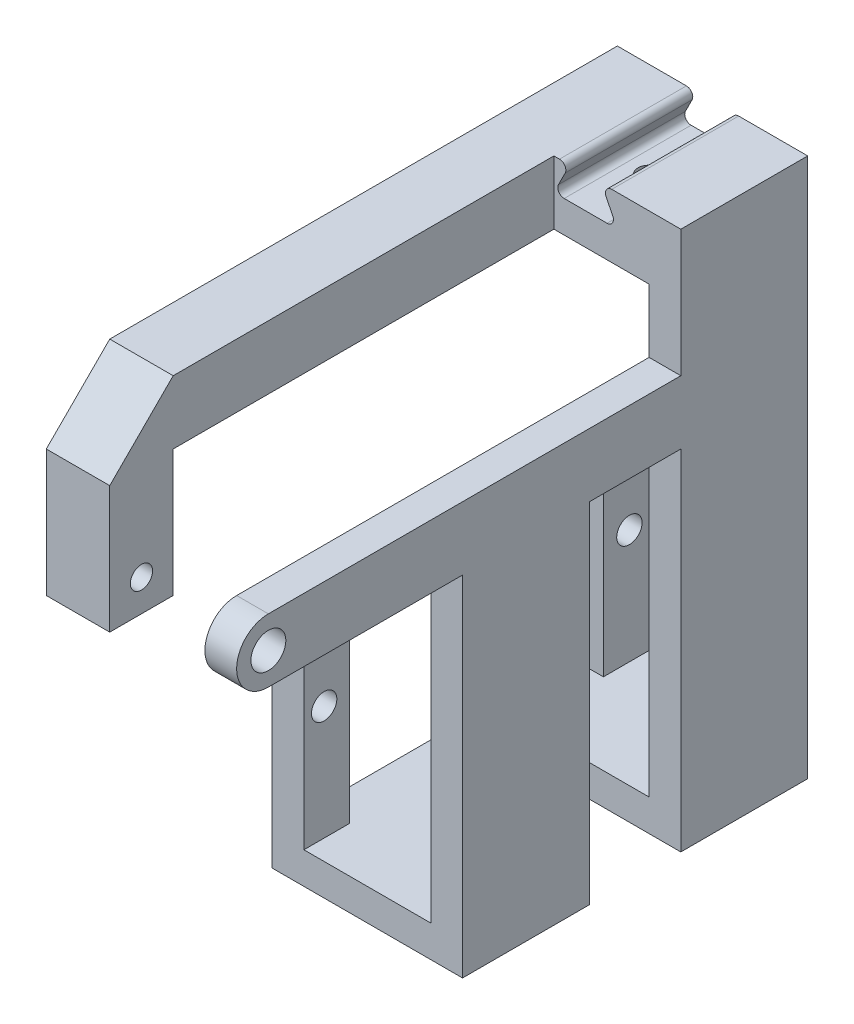
from build123d import *

# Parameters (mm, degrees)
ESBO_O1_W                   = 5
ESBO_O1_H                   = 33
RESSALTO_EXTRUS_O1_DEPTH    = 80
ESBO_O2_W                   = 40
ESBO_O2_H                   = 33
ESBO_O2_W_2                 = 25.6
CORTE_EXTRUS_O1_DEPTH       = 19
ESBO_O4_R                   = 2
CORTE_EXTRUS_O3_DEPTH       = 12
ESBO_O5_W                   = 10
ESBO_O5_H                   = 20
RESSALTO_EXTRUS_O2_DEPTH    = 10
ESBO_O6_R                   = 1.75
CORTE_EXTRUS_O4_DEPTH       = 15
CORTE_EXTRUS_O5_DEPTH       = 5
ESBO_O8_R                   = 5
ESBO_O8_R_2                 = 2.75
RESSALTO_EXTRUS_O3_DEPTH    = 5
ESBO_O9_W                   = 20
ESBO_O9_H                   = 20
ESBO_O9_W_2                 = 25
ESBO_O9_H_2                 = 10
CORTE_EXTRUS_O6_DEPTH       = 25.6
CORTE_EXTRUS_O7_START       = -20
ESBO_O11_W                  = 34.4
ESBO_O11_H                  = 20
ESBO_O11_W_2                = 14.4
ESBO_O11_H_2                = 60
CORTE_EXTRUS_O7_DEPTH       = 20
ESBO_O12_R                  = 1.75
CORTE_EXTRUS_O8_DEPTH       = 25
CORTE_EXTRUS_O9_DEPTH       = 2.5
FILETE1_R                   = 1
FILETE2_R                   = 1
CORTE_EXTRUS_O10_DEPTH      = 74
CORTE_EXTRUS_O10_DEPTH_BACK = 84
ESBO_O14_W                  = 30
ESBO_O14_H                  = 90
ESBO_O15_W                  = 30
ESBO_O15_H                  = 5
CORTE_EXTRUS_O11_DEPTH      = 120
ESBO_O16_R                  = 1
CORTE_EXTRUS_O12_DEPTH      = 2


with BuildPart() as part:
    # Esboço1 → Ressalto-extrusão1 (new body)
    with BuildSketch(Plane.XY):
        Polygon((-2.5, 45), (-15, 45), (-15, 35), (-10, 35), (15, 35), (15, 45), (2.5, 45), (5, 40), (-5, 40), align=None)
        Polygon((-10, 35), (-15, 35), (-15, -45), (-10, -45), (-10, -35), align=None)
        Polygon((-10, -35), (-10, -45), (15, -45), (15, -35), (10, -35), align=None)
        with Locations((12.5, -18.5)):
            Rectangle(ESBO_O1_W, ESBO_O1_H)
    extrude(amount=RESSALTO_EXTRUS_O1_DEPTH)

    # Esboço2 → Corte-extrusão1 (cut)
    with BuildSketch(Plane(origin=(15, 0, 0), x_dir=(0, 0, -1), z_dir=(1, 0, 0))):
        with Locations((-27.2, -18.5)):
            Rectangle(ESBO_O2_W, ESBO_O2_H)
        with Locations((-67.2, -18.5)):
            Rectangle(ESBO_O2_W_2, ESBO_O2_H)
    extrude(amount=-CORTE_EXTRUS_O1_DEPTH, mode=Mode.SUBTRACT)

    # Esboço4 → Corte-extrusão3 (cut)
    with BuildSketch(Plane.ZY.offset(-10)):
        with Locations(Location((3.104223841, -7.000828192, 0), (0, 0, 270))):
            Circle(ESBO_O4_R)
        with Locations(Location((3.104223841, -17.002484575, 0), (0, 0, 270))):
            Circle(ESBO_O4_R)
        with Locations(Location((51.210481376, -17.002484575, 0), (0, 0, 270))):
            Circle(ESBO_O4_R)
        with Locations(Location((51.210481376, -7.000828192, 0), (0, 0, 270))):
            Circle(ESBO_O4_R)
    extrude(amount=-CORTE_EXTRUS_O3_DEPTH, mode=Mode.SUBTRACT)

    # Esboço5 → Ressalto-extrusão2 (add)
    with BuildSketch(Plane(origin=(15, 0, 0), x_dir=(0, 0, -1), z_dir=(1, 0, 0))):
        with Locations((-85, 25)):
            Rectangle(ESBO_O5_W, ESBO_O5_H)
        Polygon((-90, 35), (-80, 45), (-80, 35), align=None)
    extrude(amount=-RESSALTO_EXTRUS_O2_DEPTH)

    # Esboço6 → Corte-extrusão4 (cut)
    with BuildSketch(Plane(origin=(15, 0, 0), x_dir=(0, 0, -1), z_dir=(1, 0, 0))):
        with Locations(Location((-85, 20, 0), (0, 0, 90))):
            Circle(ESBO_O6_R)
    extrude(amount=-CORTE_EXTRUS_O4_DEPTH, mode=Mode.SUBTRACT)

    # Esboço7 → Corte-extrusão5 (cut)
    with BuildSketch(Plane(origin=(15, 0, 0), x_dir=(0, 0, -1), z_dir=(1, 0, 0))):
        Polygon((-81.75, 21.876388375), (-85, 23.75277675), (-88.25, 21.876388375), (-88.25, 18.123611625), (-85, 16.24722325), (-81.75, 18.123611625), align=None)
    extrude(amount=-CORTE_EXTRUS_O5_DEPTH, mode=Mode.SUBTRACT)

    # Esboço8 → Ressalto-extrusão3 (add)
    # profile 1 of 3: a face of its own
    with BuildSketch(Plane.ZY.offset(15)):
        with BuildLine():
            Line((80, 25), (80, 20.00000004))
            ThreePointArc((80, 20.00000004), (81.464466108, 23.53553392), (85, 25))
            Line((85, 25), (80, 25))
        make_face()
    # profile 2 of 3: a face of its own
    with BuildSketch(Plane.ZY.offset(15)):
        with Locations((85, 20)):
            Circle(ESBO_O8_R)
        with Locations(Location((85, 20, 0), (0, 0, 270))):
            Circle(ESBO_O8_R_2, mode=Mode.SUBTRACT)
    # profile 3 of 3: a face of its own
    with BuildSketch(Plane.ZY.offset(15)):
        with BuildLine():
            Line((80, 15), (85, 15))
            ThreePointArc((85, 15), (81.46446608, 16.464466108), (80, 20.00000004))
            Line((80, 20.00000004), (80, 15))
        make_face()
    extrude(amount=-RESSALTO_EXTRUS_O3_DEPTH)

    # Esboço9 → Corte-extrusão6 (cut)
    with BuildSketch(Plane.XY.offset(80)):
        with Locations((-5, 35)):
            Rectangle(ESBO_O9_W, ESBO_O9_H)
        Polygon((-15, 15), (-15, -45), (-10, -45), (-10, -35), (-10, 15), align=None)
        with Locations((2.5, -40)):
            Rectangle(ESBO_O9_W_2, ESBO_O9_H_2)
    extrude(amount=-CORTE_EXTRUS_O6_DEPTH, mode=Mode.SUBTRACT)

    # Esboço11 → Corte-extrusão7 (cut)
    with BuildSketch(Plane.ZY.offset(15).offset(CORTE_EXTRUS_O7_START)):
        with Locations((37.2, 35)):
            Rectangle(ESBO_O11_W, ESBO_O11_H)
        with Locations((27.2, -15)):
            Rectangle(ESBO_O11_W_2, ESBO_O11_H_2)
    extrude(amount=CORTE_EXTRUS_O7_DEPTH, mode=Mode.SUBTRACT)

    # Esboço12 → Corte-extrusão8 (cut)
    with BuildSketch(Plane(origin=(0, 40, 0), x_dir=(1, 0, 0), z_dir=(0, 1, 0))):
        with Locations(Location((0, -10, 0), (0, 0, 270))):
            Circle(ESBO_O12_R)
    extrude(amount=-CORTE_EXTRUS_O8_DEPTH, mode=Mode.SUBTRACT)

    # Esboço13 → Corte-extrusão9 (cut)
    with BuildSketch(Plane.XZ.offset(-35)):
        Polygon((0, 6.24722325), (3.25, 8.123611625), (3.25, 11.876388375), (0, 13.75277675), (-3.25, 11.876388375), (-3.25, 8.123611625), align=None)
    extrude(amount=-CORTE_EXTRUS_O9_DEPTH, mode=Mode.SUBTRACT)

    # Filete1
    filete1_edges = [part.edges().sort_by_distance(p)[0] for p in [
        (2.5, 45, 10),
        (-2.5, 45, 10),
    ]]
    fillet(filete1_edges, radius=FILETE1_R)

    # Filete2
    filete2_edges = [part.edges().sort_by_distance(p)[0] for p in [
        (-5, 40, 10),
        (5, 40, 10),
    ]]
    fillet(filete2_edges, radius=FILETE2_R)

    # Espelhar1: part across plane


with BuildPart() as part_1:
    add(part.part)
    add(part.part.mirror(Plane(origin=(15, 0, 80), x_dir=(0, 0, 1), z_dir=(1, 0, 0))))

    # Esboço14 → Corte-extrusão10 (cut, two sides: drawn at the far end of the back side and taken through both)
    with BuildSketch(Plane.XY.offset(54.4).offset(-CORTE_EXTRUS_O10_DEPTH_BACK)):
        Rectangle(ESBO_O14_W, ESBO_O14_H)
    extrude(amount=CORTE_EXTRUS_O10_DEPTH + CORTE_EXTRUS_O10_DEPTH_BACK, mode=Mode.SUBTRACT)

    # Esboço15 → Corte-extrusão11 (cut)
    with BuildSketch(Plane.XY.offset(54.4)):
        with Locations((30, -42.5)):
            Rectangle(ESBO_O15_W, ESBO_O15_H)
    extrude(amount=-CORTE_EXTRUS_O11_DEPTH, mode=Mode.SUBTRACT)

    # Esboço16 → Corte-extrusão12 (cut)
    with BuildSketch(Plane.ZY.offset(-40)):
        with Locations(Location((29.4, 20, 0), (0, 0, 270))):
            Circle(ESBO_O16_R)
        with Locations(Location((44.4, 10, 0), (0, 0, 270))):
            Circle(ESBO_O16_R)
    extrude(amount=-CORTE_EXTRUS_O12_DEPTH, mode=Mode.SUBTRACT)


solid = part_1.part
